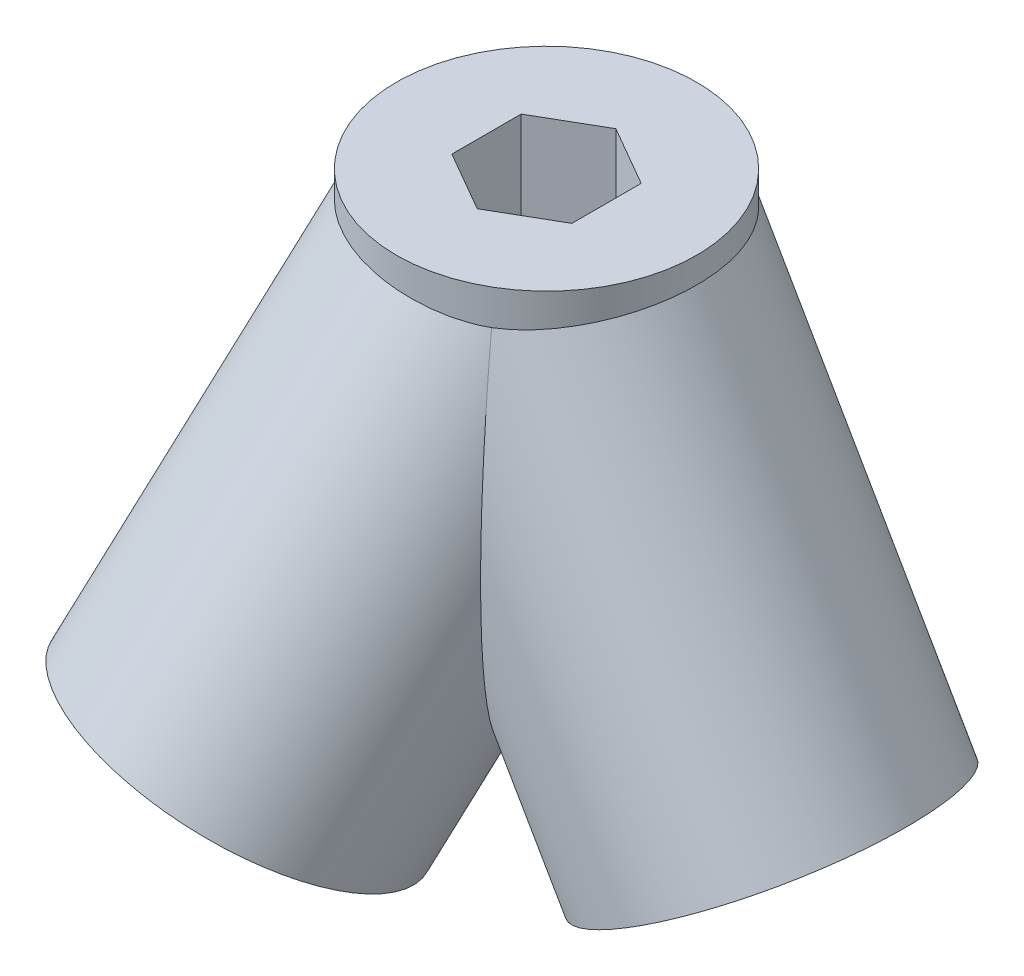
from build123d import *

# Parameters (mm, degrees)
SKETCH2_R                = 20.8
SKETCH2_R_2              = 16.8
BOSS_EXTRUDE2_DEPTH      = 60
CIRPATTERN1_COUNT        = 3
BOSS_EXTRUDE7_DEPTH      = 10.4
BOSS_EXTRUDE7_DEPTH_BACK = 10
SKETCH5_R                = 20
SKETCH5_R_2              = 2.5
CUT_EXTRUDE1_DEPTH       = 20


with BuildPart() as part:
    # Sketch2 → Boss-Extrude2 (new body)
    with BuildSketch(Plane(origin=(0, 0, 0), x_dir=(0, 0, -1), z_dir=(-0.500000000000001, 0.866025403784438, 0))):
        with Locations(Location((0, 0, 0), (0, 0, 90))):
            Circle(SKETCH2_R)
        with Locations(Location((0, 0, 0), (0, 0, 90))):
            Circle(SKETCH2_R_2, mode=Mode.SUBTRACT)
    boss_extrude2 = extrude(amount=-BOSS_EXTRUDE2_DEPTH)

    # CirPattern1: Boss-Extrude2 ×3 about axis
    cirpattern1_axis = Axis((0, 0, 0), (0, 1, 0))
    for i in range(1, CIRPATTERN1_COUNT):
        add(boss_extrude2.rotate(cirpattern1_axis, i * 360 / CIRPATTERN1_COUNT))

    # Sketch5 → Boss-Extrude7 (add, two sides: drawn at the far end of the back side and taken through both)
    with BuildSketch(Plane(origin=(0, 0, 0), x_dir=(1, 0, 0), z_dir=(0, 1, 0)).offset(-BOSS_EXTRUDE7_DEPTH_BACK)):
        with Locations(Location((0, 0, 0), (0, 0, 270))):
            Circle(SKETCH5_R)
        with Locations(Location((0, 0, 0), (0, 0, 270))):
            Circle(SKETCH5_R_2, mode=Mode.SUBTRACT)
    extrude(amount=BOSS_EXTRUDE7_DEPTH + BOSS_EXTRUDE7_DEPTH_BACK)

    # Sketch6 → Cut-Extrude1 (cut)
    with BuildSketch(Plane(origin=(0, 10.4, 0), x_dir=(1, 0, 0), z_dir=(0, 1, 0))):
        Polygon((0, 9.237604307), (-8, 4.618802154), (-8, -4.618802154), (0, -9.237604307), (8, -4.618802154), (8, 4.618802154), align=None)
    extrude(amount=-CUT_EXTRUDE1_DEPTH, mode=Mode.SUBTRACT)


solid = part.part
